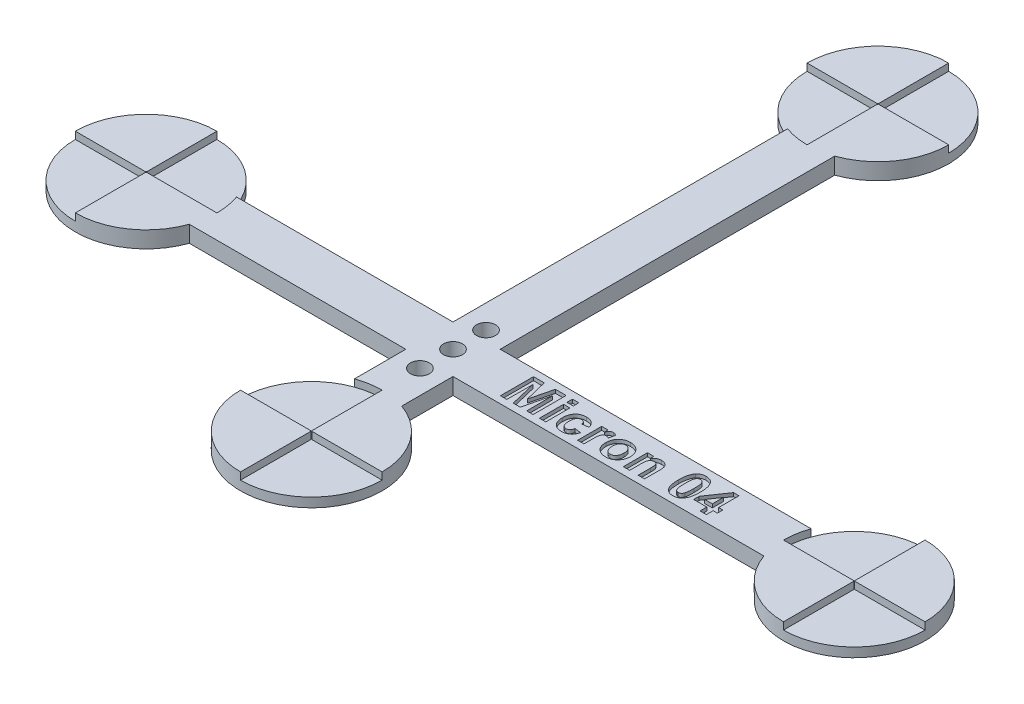
from build123d import *

# Parameters (mm, degrees)
BOSS_EXTRUDE1_DEPTH = 3.5
CUT_EXTRUDE1_START  = -1.52
CUT_EXTRUDE1_DEPTH  = 1.52
SKETCH3_R           = 2
CUT_EXTRUDE2_DEPTH  = 196.607387386
SKETCH5_W           = 1.346153846
SKETCH5_H           = 1.166666667
SKETCH5_H_2         = 5.115384615
CUT_EXTRUDE3_DEPTH  = 0.75


with BuildPart() as part:
    # Sketch1 → Boss-Extrude1 (new body)
    with BuildSketch(Plane(origin=(0, 0, 0), x_dir=(1, 0, 0), z_dir=(0, 1, 0))):
        with BuildLine():
            Line((60, 75.857864376), (60, 5))
            Line((60, 5), (14.142135624, 5))
            ThreePointArc((14.142135624, 5), (-15, 0), (14.142135624, -5))
            Line((14.142135624, -5), (60, -5))
            Line((60, -5), (60, -15.857864376))
            ThreePointArc((60, -15.857864376), (65, -45), (70, -15.857864376))
            Line((70, -15.857864376), (70, -5))
            Line((70, -5), (135.857864376, -5))
            ThreePointArc((135.857864376, -5), (165, 0), (135.857864376, 5))
            Line((135.857864376, 5), (70, 5))
            Line((70, 5), (70, 75.857864376))
            ThreePointArc((70, 75.857864376), (65, 105), (60, 75.857864376))
        make_face()
    extrude(amount=BOSS_EXTRUDE1_DEPTH)

    # Sketch2 → Cut-Extrude1 (cut)
    with BuildSketch(Plane(origin=(0, 3.5, 0), x_dir=(1, 0, 0), z_dir=(0, 1, 0)).offset(CUT_EXTRUDE1_START)):
        with BuildLine():
            Line((65, -45), (65, -30.1))
            ThreePointArc((65, -30.1), (64.929289322, -30.070710678), (64.9, -30))
            Line((64.9, -30), (50, -30))
            ThreePointArc((50, -30), (54.393398282, -19.393398282), (65, -15))
            Line((65, -15), (65, -29.9))
            ThreePointArc((65, -29.9), (65.070710678, -29.929289322), (65.1, -30))
            Line((65.1, -30), (80, -30))
            ThreePointArc((80, -30), (75.606601718, -40.606601718), (65, -45))
        make_face()
        with BuildLine():
            Line((-15, 0), (-0.1, 0))
            ThreePointArc((-0.1, 0), (-0.070710678, 0.070710678), (0, 0.1))
            Line((0, 0.1), (0, 15))
            ThreePointArc((0, 15), (10.606601718, 10.606601718), (15, 0))
            Line((15, 0), (0.1, 0))
            ThreePointArc((0.1, 0), (0.070710678, -0.070710678), (0, -0.1))
            Line((0, -0.1), (0, -15))
            ThreePointArc((0, -15), (-10.606601718, -10.606601718), (-15, 0))
        make_face()
        with BuildLine():
            Line((50, 90), (64.9, 90))
            ThreePointArc((64.9, 90), (64.929289322, 90.070710678), (65, 90.1))
            Line((65, 90.1), (65, 105))
            ThreePointArc((65, 105), (75.606601718, 100.606601718), (80, 90))
            Line((80, 90), (65.1, 90))
            ThreePointArc((65.1, 90), (65.070710678, 89.929289322), (65, 89.9))
            Line((65, 89.9), (65, 75))
            ThreePointArc((65, 75), (54.393398282, 79.393398282), (50, 90))
        make_face()
        with BuildLine():
            Line((150, 15), (150, 0.1))
            ThreePointArc((150, 0.1), (150.070710678, 0.070710678), (150.1, 0))
            Line((150.1, 0), (165, 0))
            ThreePointArc((165, 0), (160.606601718, -10.606601718), (150, -15))
            Line((150, -15), (150, -0.1))
            ThreePointArc((150, -0.1), (149.929289322, -0.070710678), (149.9, 0))
            Line((149.9, 0), (135, 0))
            ThreePointArc((135, 0), (139.393398282, 10.606601718), (150, 15))
        make_face()
    extrude(amount=CUT_EXTRUDE1_DEPTH, mode=Mode.SUBTRACT)

    # Sketch3 → Cut-Extrude2 (cut, through all)
    with BuildSketch(Plane(origin=(0, 3.5, 0), x_dir=(1, 0, 0), z_dir=(0, 1, 0))):
        with Locations(Location((65, 0, 0), (0, 0, 270))):
            Circle(SKETCH3_R)
        with Locations(Location((65, 7, 0), (0, 0, 270))):
            Circle(SKETCH3_R)
        with Locations(Location((65, -7, 0), (0, 0, 270))):
            Circle(SKETCH3_R)
    extrude(amount=-CUT_EXTRUDE2_DEPTH, mode=Mode.SUBTRACT)

    # Sketch5 → Cut-Extrude3 (cut)
    # profile 1 of 9: a face of its own
    with BuildSketch(Plane(origin=(0, 3.5, 0), x_dir=(1, 0, 0), z_dir=(0, 1, 0))):
        Polygon((78.557137316, -3.5), (78.557137316, 3.5), (80.834380906, 3.5), (82.012265521, -1.274639423), (83.190150137, 3.5), (85.467393727, 3.5), (85.467393727, -3.5), (84.12123988, -3.5), (84.076368086, 2.010817308), (82.762465842, -3.5), (81.262065201, -3.5), (79.948162957, 2.010817308), (79.903291162, -3.5), align=None)
    # profile 2 of 9: a face of its own
    with BuildSketch(Plane(origin=(0, 3.5, 0), x_dir=(1, 0, 0), z_dir=(0, 1, 0))):
        with Locations((87.486624496, 2.916666667)):
            Rectangle(SKETCH5_W, SKETCH5_H)
    # profile 3 of 9: a face of its own
    with BuildSketch(Plane(origin=(0, 3.5, 0), x_dir=(1, 0, 0), z_dir=(0, 1, 0))):
        with Locations((87.486624496, -0.942307692)):
            Rectangle(SKETCH5_W, SKETCH5_H_2)
    # profile 4 of 9: a face of its own
    with BuildSketch(Plane(origin=(0, 3.5, 0), x_dir=(1, 0, 0), z_dir=(0, 1, 0))):
        with BuildLine():
            Line((93.723803983, 0.08974359), (92.377650137, -0.08974359))
            add(Edge.make_bspline(
                [(92.377650137, -0.08974359), (92.365277654, -0.026702881), (92.341673882, 0.09356389), (92.281826173, 0.260113107), (92.199974577, 0.401670835), (92.097611893, 0.51732494), (91.97712351, 0.607450251), (91.840268759, 0.673171422), (91.685581657, 0.711401306), (91.577185865, 0.715710363), (91.520879304, 0.717948718)],
                knots=[0, 0, 0, 0, 1.183520367, 2.2578771, 3.246797608, 4.180863388, 5.085846032, 6.003342148, 6.962829327, 8, 8, 8, 8], degree=3))
            add(Edge.make_bspline(
                [(91.520879304, 0.717948718), (91.482498221, 0.716894897), (91.407684642, 0.714840756), (91.298251479, 0.698098117), (91.195737937, 0.667745464), (91.097523133, 0.629114343), (91.006836345, 0.576495155), (90.920991012, 0.514299213), (90.842675236, 0.439090326), (90.769257744, 0.353129964), (90.701753909, 0.253995306), (90.647051205, 0.137976859), (90.599085607, 0.00804074), (90.560102543, -0.137503523), (90.530047591, -0.298346655), (90.507427047, -0.474341951), (90.495339603, -0.665426066), (90.493822197, -0.797860734), (90.493034752, -0.866586538)],
                knots=[0, 0, 0, 0, 0.862078219, 1.680389174, 2.478024961, 3.259954283, 4.04533088, 4.826625376, 5.636266677, 6.477958853, 7.363321064, 8.321359119, 9.351280941, 10.472100686, 11.701575432, 13.024867311, 14.456081111, 16, 16, 16, 16], degree=3))
            add(Edge.make_bspline(
                [(90.493034752, -0.866586538), (90.493639899, -0.942801282), (90.494806774, -1.089762544), (90.509341595, -1.301712899), (90.531002417, -1.496036651), (90.561525189, -1.673267835), (90.601624875, -1.832782613), (90.650795425, -1.975411342), (90.707047794, -2.101633999), (90.776070584, -2.209065714), (90.850031931, -2.303056702), (90.933314865, -2.381466575), (91.019308158, -2.451942196), (91.114884123, -2.505825956), (91.214352737, -2.550853781), (91.321603773, -2.578852356), (91.433547011, -2.60039896), (91.510950539, -2.601834056), (91.550326419, -2.602564103)],
                knots=[0, 0, 0, 0, 1.594318435, 3.074248329, 4.44256617, 5.683784585, 6.834147545, 7.879495874, 8.83778105, 9.716843238, 10.544636748, 11.333080285, 12.105903466, 12.864046512, 13.621684801, 14.38335177, 15.177596319, 16, 16, 16, 16], degree=3))
            add(Edge.make_bspline(
                [(91.550326419, -2.602564103), (91.608100413, -2.600080116), (91.720157046, -2.595262252), (91.879276685, -2.552096012), (92.022202191, -2.482192159), (92.125844391, -2.400004579), (92.201111917, -2.320853296), (92.250138108, -2.247946339), (92.299458931, -2.168177702), (92.339930185, -2.075871785), (92.380235919, -1.975436952), (92.412480151, -1.86369039), (92.444507148, -1.743466381), (92.459601538, -1.65899259), (92.467393727, -1.615384615)],
                knots=[0, 0, 0, 0, 1.391704634, 2.699306801, 3.945045311, 5.206156062, 5.868460975, 6.572467336, 7.320954464, 8.128297893, 8.999513781, 9.930638866, 10.931732014, 12, 12, 12, 12], degree=3))
            Line((92.467393727, -1.615384615), (93.813547573, -1.794871795))
            add(Edge.make_bspline(
                [(93.813547573, -1.794871795), (93.795825896, -1.866656924), (93.76109447, -2.007343377), (93.693590707, -2.209373129), (93.61479608, -2.39820651), (93.525624874, -2.574376956), (93.422745577, -2.73598165), (93.309013151, -2.88413537), (93.183178776, -3.017960811), (93.046861568, -3.139555075), (92.897935718, -3.246410319), (92.736172899, -3.337665389), (92.563936639, -3.416820643), (92.378388792, -3.479144939), (92.181836268, -3.530502493), (91.972413371, -3.564327421), (91.751309208, -3.58604953), (91.599927011, -3.588491221), (91.522281547, -3.58974359)],
                knots=[0, 0, 0, 0, 1.110268429, 2.175934317, 3.195555169, 4.181481111, 5.137790904, 6.068820232, 6.982751273, 7.892872169, 8.808581235, 9.729898078, 10.678730826, 11.651191499, 12.666063818, 13.726769105, 14.834036833, 16, 16, 16, 16], degree=3))
            add(Edge.make_bspline(
                [(91.522281547, -3.58974359), (91.433837068, -3.587598112), (91.261478322, -3.583417051), (91.009756242, -3.550566524), (90.771780691, -3.496564037), (90.547501703, -3.418433664), (90.33596962, -3.32101378), (90.139359833, -3.198661043), (89.956602846, -3.055097693), (89.788125382, -2.890737636), (89.63650412, -2.707369312), (89.505615698, -2.505114604), (89.394554044, -2.286498364), (89.303031081, -2.051298732), (89.233226582, -1.7983952), (89.183681025, -1.529069784), (89.151714713, -1.243154327), (89.148519923, -1.047097203), (89.146880906, -0.946514423)],
                knots=[0, 0, 0, 0, 1.056003706, 2.057917874, 3.026125023, 3.965316587, 4.889355399, 5.801804771, 6.724223409, 7.659808022, 8.607570672, 9.559810849, 10.530974559, 11.531347954, 12.568834288, 13.659317828, 14.799164681, 16, 16, 16, 16], degree=3))
            add(Edge.make_bspline(
                [(89.146880906, -0.946514423), (89.148524185, -0.844997295), (89.151727972, -0.647076357), (89.18360297, -0.358828298), (89.233094763, -0.087580716), (89.30349607, 0.166297338), (89.392466257, 0.40326616), (89.504363423, 0.62183937), (89.635046938, 0.82419118), (89.786794153, 1.007446493), (89.954769379, 1.171954778), (90.138621428, 1.31436025), (90.335702579, 1.436043892), (90.547842096, 1.534147473), (90.773642785, 1.612120293), (91.013992037, 1.665925315), (91.268498667, 1.698802364), (91.442718724, 1.702983298), (91.532097252, 1.705128205)],
                knots=[0, 0, 0, 0, 1.206261992, 2.351765734, 3.442553085, 4.480484798, 5.479315179, 6.445885781, 7.393622348, 8.336902565, 9.26806234, 10.182699256, 11.09556262, 12.0152312, 12.955233282, 13.92969179, 14.937888647, 16, 16, 16, 16], degree=3))
            add(Edge.make_bspline(
                [(91.532097252, 1.705128205), (91.605070142, 1.704384231), (91.747559928, 1.702931518), (91.955377865, 1.681938632), (92.151931544, 1.652324627), (92.3370707, 1.608373074), (92.510877772, 1.55291005), (92.67305557, 1.48425635), (92.822943463, 1.401899226), (92.962440511, 1.308174096), (93.090726225, 1.200105), (93.210447231, 1.080931127), (93.320267383, 0.947732157), (93.421478043, 0.802315403), (93.510713897, 0.64234233), (93.592738582, 0.470830941), (93.663920966, 0.285320122), (93.703546565, 0.155903844), (93.723803983, 0.08974359)],
                knots=[0, 0, 0, 0, 1.178528697, 2.301242291, 3.371523624, 4.388184023, 5.372173667, 6.316227488, 7.228761945, 8.131556558, 9.02696084, 9.934795517, 10.857276148, 11.812560878, 12.793328268, 13.813516901, 14.882225015, 16, 16, 16, 16], degree=3))
        make_face()
    # profile 5 of 9: a face of its own
    with BuildSketch(Plane(origin=(0, 3.5, 0), x_dir=(1, 0, 0), z_dir=(0, 1, 0))):
        with BuildLine():
            Line((96.236624496, -3.5), (94.89047065, -3.5))
            Line((94.89047065, -3.5), (94.89047065, 1.615384615))
            Line((94.89047065, 1.615384615), (96.236624496, 1.615384615))
            Line((96.236624496, 1.615384615), (96.236624496, 0.901642628))
            add(Edge.make_bspline(
                [(96.236624496, 0.901642628), (96.259883743, 0.941904311), (96.304756328, 1.019578614), (96.371134323, 1.130348316), (96.437190473, 1.229067778), (96.502313101, 1.315738052), (96.562695006, 1.393610289), (96.624125097, 1.458290396), (96.681838486, 1.513862665), (96.759057766, 1.569417784), (96.85816177, 1.623638198), (96.982722375, 1.672376349), (97.116123027, 1.699014333), (97.206867798, 1.7030602), (97.253251098, 1.705128205)],
                knots=[0, 0, 0, 0, 1.218987753, 2.351715484, 3.384890168, 4.330893419, 5.1939795, 5.965577503, 6.66790098, 7.29043559, 8.453252551, 9.620708942, 10.783848683, 12, 12, 12, 12], degree=3))
            add(Edge.make_bspline(
                [(97.253251098, 1.705128205), (97.320405095, 1.701358096), (97.455282291, 1.693785921), (97.655090934, 1.639699112), (97.849368018, 1.548142305), (97.969512799, 1.464847397), (98.031496291, 1.421875)],
                knots=[0, 0, 0, 0, 0.956058025, 1.920219652, 2.927027487, 4, 4, 4, 4], degree=3))
            Line((98.031496291, 1.421875), (97.717393727, 0.141626603))
            add(Edge.make_bspline(
                [(97.717393727, 0.141626603), (97.664449803, 0.174925236), (97.563581431, 0.238365546), (97.406138295, 0.305762948), (97.25470486, 0.349888023), (97.154428404, 0.35601587), (97.106015521, 0.358974359)],
                knots=[0, 0, 0, 0, 1.139741959, 2.17142794, 3.117176162, 4, 4, 4, 4], degree=3))
            add(Edge.make_bspline(
                [(97.106015521, 0.358974359), (97.062383442, 0.357110478), (96.977443556, 0.353482004), (96.855168651, 0.324585509), (96.742438401, 0.278028965), (96.638804629, 0.211102954), (96.546124762, 0.117496866), (96.466335118, -0.005816935), (96.399557381, -0.159976511), (96.348517599, -0.309611834), (96.316692358, -0.455051639), (96.294248724, -0.593539742), (96.277196049, -0.759330249), (96.261585532, -0.951920701), (96.251121722, -1.171736755), (96.242884255, -1.418086441), (96.236934639, -1.691545137), (96.236731023, -1.882742337), (96.236624496, -1.982772436)],
                knots=[0, 0, 0, 0, 0.752818562, 1.4655346, 2.15662141, 2.850671748, 3.581264886, 4.414089304, 5.371394652, 6.476667933, 7.138571115, 7.940099809, 8.898357565, 10.015825393, 11.276710544, 12.698206094, 14.272575274, 16, 16, 16, 16], degree=3))
            Line((96.236624496, -1.982772436), (96.236624496, -3.5))
        make_face()
    # profile 6 of 9: a face of its own
    with BuildSketch(Plane(origin=(0, 3.5, 0), x_dir=(1, 0, 0), z_dir=(0, 1, 0))):
        with BuildLine():
            add(Edge.make_bspline(
                [(98.30072706, -0.870793269), (98.305045962, -0.760235903), (98.313692137, -0.538906871), (98.37545065, -0.210134176), (98.479986613, 0.112038713), (98.596998472, 0.373436964), (98.712536167, 0.573274145), (98.805840225, 0.717377785), (98.910004027, 0.850655554), (99.022895624, 0.973952054), (99.141975554, 1.090223099), (99.271436787, 1.195191373), (99.409604934, 1.290665645), (99.555130892, 1.377699163), (99.70780662, 1.45411696), (99.864797668, 1.522044624), (100.026738449, 1.577858255), (100.192500665, 1.624143401), (100.362803099, 1.66126573), (100.537692719, 1.68557028), (100.716957733, 1.701776453), (100.837816813, 1.704000672), (100.899084432, 1.705128205)],
                knots=[0, 0, 0, 0, 1.619840069, 3.242819969, 4.882696853, 6.574901176, 7.427927767, 8.263869039, 9.088735507, 9.903385011, 10.712399333, 11.525463381, 12.34252837, 13.171904741, 14.008210778, 14.842888174, 15.67691885, 16.516221154, 17.363978437, 18.229048737, 19.10224397, 20, 20, 20, 20], degree=3))
            add(Edge.make_bspline(
                [(100.899084432, 1.705128205), (100.992210311, 1.703136544), (101.175407967, 1.69921854), (101.443599, 1.663530133), (101.69856042, 1.604734262), (101.940636298, 1.522866388), (102.170009096, 1.417918164), (102.385525042, 1.287469155), (102.588964705, 1.13534666), (102.776477597, 0.960622814), (102.947873031, 0.769310702), (103.096522834, 0.562484273), (103.223397384, 0.344144411), (103.328477544, 0.113944009), (103.408239879, -0.129331778), (103.463344151, -0.385087436), (103.500243667, -0.652374343), (103.50396088, -0.835142162), (103.505855265, -0.928285256)],
                knots=[0, 0, 0, 0, 1.076054793, 2.116819909, 3.120736197, 4.09633837, 5.065772102, 6.030360709, 7.002891056, 7.996945094, 8.988102315, 9.967288529, 10.93568283, 11.902870597, 12.887008047, 13.888537105, 14.923945207, 16, 16, 16, 16], degree=3))
            add(Edge.make_bspline(
                [(103.505855265, -0.928285256), (103.503953336, -1.022358858), (103.500230128, -1.20651696), (103.463550334, -1.47628572), (103.406832368, -1.734301905), (103.325441844, -1.980042151), (103.220586913, -2.213224526), (103.094263796, -2.434645511), (102.943126034, -2.643140663), (102.770071096, -2.836536926), (102.580135887, -3.012216977), (102.378157233, -3.168393642), (102.161698021, -3.297146595), (101.934555313, -3.405413896), (101.694392155, -3.48757604), (101.442576838, -3.546181121), (101.179301383, -3.58440277), (100.999247208, -3.587940756), (100.907497893, -3.58974359)],
                knots=[0, 0, 0, 0, 1.084306555, 2.122634113, 3.133511532, 4.127271514, 5.10202058, 6.077484774, 7.061903265, 8.065960046, 9.065303363, 10.042062392, 11.004391854, 11.964060687, 12.939122686, 13.924942149, 14.942623041, 16, 16, 16, 16], degree=3))
            add(Edge.make_bspline(
                [(100.907497893, -3.58974359), (100.793197459, -3.585999314), (100.565409876, -3.578537406), (100.228332141, -3.517331391), (99.899580393, -3.418578363), (99.634721788, -3.30491006), (99.432398884, -3.194068459), (99.2889167, -3.100765628), (99.153600151, -3.000634417), (99.029615405, -2.888525117), (98.914822638, -2.767656905), (98.80770116, -2.639200059), (98.712065202, -2.500189519), (98.625243515, -2.353150853), (98.547337372, -2.197033104), (98.482391397, -2.031407384), (98.425965203, -1.858219085), (98.379426741, -1.677074935), (98.344918868, -1.487198195), (98.319828269, -1.289197267), (98.304105213, -1.082783839), (98.301867118, -0.942335777), (98.30072706, -0.870793269)],
                knots=[0, 0, 0, 0, 1.610846835, 3.210231987, 4.81374032, 6.443368681, 7.263437361, 8.06418174, 8.855100662, 9.634539345, 10.417731031, 11.204243685, 11.990424874, 12.794120493, 13.610605693, 14.447765341, 15.300248309, 16.177865431, 17.082777535, 18.019649293, 18.991233806, 20, 20, 20, 20], degree=3))
        make_face()
        with BuildLine():
            add(Edge.make_bspline(
                [(99.646880906, -0.942307692), (99.647878584, -1.007320767), (99.649820064, -1.133836228), (99.667123886, -1.317908247), (99.693943922, -1.490762442), (99.735361519, -1.650791958), (99.785307076, -1.800159307), (99.848707519, -1.936877885), (99.921153825, -2.063536994), (100.007373027, -2.1753987), (100.101343593, -2.274418694), (100.199833871, -2.36240354), (100.303809872, -2.437322036), (100.41391022, -2.49823268), (100.529998823, -2.544473448), (100.650705668, -2.578404662), (100.776898878, -2.59833825), (100.862556349, -2.601139991), (100.90609565, -2.602564103)],
                knots=[0, 0, 0, 0, 1.334287467, 2.596523749, 3.792235791, 4.920928783, 5.98599801, 7.020725633, 8.009778093, 8.975087571, 9.91178927, 10.809031968, 11.682407688, 12.537028737, 13.385161363, 14.241880569, 15.106355953, 16, 16, 16, 16], degree=3))
            add(Edge.make_bspline(
                [(100.90609565, -2.602564103), (100.949636837, -2.601144665), (101.035298021, -2.598352119), (101.161464162, -2.578351489), (101.281853749, -2.544786823), (101.397190506, -2.497854846), (101.507005984, -2.437377328), (101.61091724, -2.362353397), (101.709336483, -2.274781598), (101.802542893, -2.175227372), (101.886267606, -2.061842509), (101.959423839, -1.935578805), (102.022822325, -1.79833688), (102.072998654, -1.64817726), (102.112146338, -1.486306038), (102.139600285, -1.312329148), (102.15676443, -1.126346658), (102.158702325, -0.99843674), (102.159701419, -0.932491987)],
                knots=[0, 0, 0, 0, 0.891374549, 1.753654511, 2.608197993, 3.445305504, 4.297756158, 5.168913853, 6.063877914, 6.991658187, 7.956416983, 8.942957645, 9.975057474, 11.046479855, 12.179282068, 13.381405243, 14.649967197, 16, 16, 16, 16], degree=3))
            add(Edge.make_bspline(
                [(102.159701419, -0.932491987), (102.158697367, -0.867950124), (102.156751088, -0.742840612), (102.139683714, -0.561031756), (102.111771172, -0.390422553), (102.073298945, -0.231185172), (102.022561895, -0.083047614), (101.959026888, 0.052619974), (101.886748624, 0.178516236), (101.80205349, 0.290714614), (101.709395678, 0.390209804), (101.610902071, 0.477726842), (101.507009908, 0.552764833), (101.397189486, 0.61323871), (101.281854027, 0.660171642), (101.161464087, 0.693736048), (101.035298041, 0.713736749), (100.949636844, 0.716529285), (100.90609565, 0.717948718)],
                knots=[0, 0, 0, 0, 1.332105243, 2.582185114, 3.76554119, 4.898206757, 5.96011018, 6.991864232, 7.986448439, 8.951336849, 9.886681577, 10.788942532, 11.667203022, 12.526603947, 13.370536632, 14.232047448, 15.101357822, 16, 16, 16, 16], degree=3))
            add(Edge.make_bspline(
                [(100.90609565, 0.717948718), (100.862556349, 0.716524606), (100.776898878, 0.713722865), (100.650705668, 0.693789278), (100.529998823, 0.659858063), (100.41391022, 0.613617296), (100.303809872, 0.552706651), (100.199833871, 0.477788156), (100.101343593, 0.38980331), (100.007373027, 0.290783316), (99.921153825, 0.17892161), (99.848707519, 0.052262501), (99.785307076, -0.084456078), (99.735361519, -0.233823426), (99.693943922, -0.393852943), (99.667123886, -0.566707137), (99.649820064, -0.750779157), (99.647878584, -0.877294617), (99.646880906, -0.942307692)],
                knots=[0, 0, 0, 0, 0.893644047, 1.758119431, 2.614838637, 3.462971263, 4.317592312, 5.190968032, 6.08821073, 7.024912429, 7.990221907, 8.979274367, 10.01400199, 11.079071217, 12.207764209, 13.403476251, 14.665712533, 16, 16, 16, 16], degree=3))
        make_face(mode=Mode.SUBTRACT)
    # profile 7 of 9: a face of its own
    with BuildSketch(Plane(origin=(0, 3.5, 0), x_dir=(1, 0, 0), z_dir=(0, 1, 0))):
        with BuildLine():
            Line((109.069957829, -3.5), (107.723803983, -3.5))
            Line((107.723803983, -3.5), (107.723803983, -0.875))
            add(Edge.make_bspline(
                [(107.723803983, -0.875), (107.723602692, -0.80862339), (107.723218494, -0.681932094), (107.718527885, -0.50151225), (107.713477967, -0.33926398), (107.705359809, -0.195690673), (107.69420945, -0.069881136), (107.680940928, 0.037381776), (107.664227581, 0.126316058), (107.640514055, 0.219075396), (107.603280694, 0.31750614), (107.542853534, 0.419454306), (107.472803641, 0.509977418), (107.387946168, 0.584030176), (107.292843867, 0.643744945), (107.188425092, 0.687766967), (107.073926815, 0.713473714), (106.994769027, 0.71642676), (106.953972252, 0.717948718)],
                knots=[0, 0, 0, 0, 1.585090075, 3.025419896, 4.30986405, 5.461533023, 6.458985685, 7.325703005, 8.041573048, 8.618245387, 9.611190897, 10.541623111, 11.439410311, 12.333024322, 13.215695708, 14.111259627, 15.026570636, 16, 16, 16, 16], degree=3))
            add(Edge.make_bspline(
                [(106.953972252, 0.717948718), (106.901446439, 0.715341443), (106.798008909, 0.710207014), (106.646127096, 0.674643139), (106.504272122, 0.611656212), (106.371854194, 0.527573319), (106.255091054, 0.423166044), (106.155813236, 0.301229295), (106.077510643, 0.163292863), (106.028725935, 0.034500293), (105.9997776, -0.082074788), (105.980077313, -0.18736516), (105.965963353, -0.310222482), (105.951055688, -0.449397921), (105.942646526, -0.606201002), (105.933263474, -0.779079665), (105.929808832, -0.969405207), (105.929233196, -1.1016966), (105.928932188, -1.170873397)],
                knots=[0, 0, 0, 0, 1.032418065, 2.033110358, 3.045378521, 4.070039643, 5.104744895, 6.110696385, 7.147805894, 8.209255037, 8.806501049, 9.507534436, 10.313289552, 11.236712342, 12.258650821, 13.399345464, 14.640085731, 16, 16, 16, 16], degree=3))
            Line((105.928932188, -1.170873397), (105.928932188, -3.5))
            Line((105.928932188, -3.5), (104.582778342, -3.5))
            Line((104.582778342, -3.5), (104.582778342, 1.615384615))
            Line((104.582778342, 1.615384615), (105.928932188, 1.615384615))
            Line((105.928932188, 1.615384615), (105.928932188, 0.877804487))
            add(Edge.make_bspline(
                [(105.928932188, 0.877804487), (105.980976174, 0.94337945), (106.08236259, 1.07112544), (106.252101926, 1.240902011), (106.431871591, 1.384984638), (106.622482327, 1.502597736), (106.823836354, 1.593383288), (107.035011442, 1.657323362), (107.256181645, 1.698687167), (107.407176778, 1.702955825), (107.484020329, 1.705128205)],
                knots=[0, 0, 0, 0, 1.096260936, 2.135615983, 3.138008533, 4.108575778, 5.062498258, 6.023394349, 6.994077526, 8, 8, 8, 8], degree=3))
            add(Edge.make_bspline(
                [(107.484020329, 1.705128205), (107.551455459, 1.703432581), (107.684254807, 1.700093404), (107.87840855, 1.668042033), (108.063790206, 1.617716821), (108.237815142, 1.547521772), (108.39780225, 1.463814733), (108.538360931, 1.365944084), (108.659178646, 1.258012012), (108.758264399, 1.136836476), (108.838935335, 1.006444736), (108.909151731, 0.869613801), (108.963410859, 0.7231182), (109.005291646, 0.56393665), (109.033684021, 0.383505727), (109.056317805, 0.173923523), (109.067737625, -0.069988674), (109.069186888, -0.243982006), (109.069957829, -0.336538462)],
                knots=[0, 0, 0, 0, 1.087471829, 2.141547729, 3.166311014, 4.181815879, 5.163737, 6.073971965, 6.939083136, 7.769667735, 8.590016746, 9.409741311, 10.247555639, 11.105633939, 12.06171977, 13.192085209, 14.506318385, 16, 16, 16, 16], degree=3))
            Line((109.069957829, -0.336538462), (109.069957829, -3.5))
        make_face()
    # profile 8 of 9: a face of its own
    with BuildSketch(Plane(origin=(0, 3.5, 0), x_dir=(1, 0, 0), z_dir=(0, 1, 0))):
        with BuildLine():
            add(Edge.make_bspline(
                [(115.127650137, 3.5), (115.210973459, 3.497990296), (115.373194416, 3.494077632), (115.609568213, 3.459418509), (115.832125907, 3.403844539), (116.040851165, 3.325286793), (116.235548447, 3.223275021), (116.414920872, 3.097373283), (116.582887972, 2.951355615), (116.679882834, 2.838043484), (116.729012316, 2.780649038)],
                knots=[0, 0, 0, 0, 1.098584764, 2.138818609, 3.143716932, 4.11936356, 5.073598562, 6.034819447, 7.004603936, 8, 8, 8, 8], degree=3))
            add(Edge.make_bspline(
                [(116.729012316, 2.780649038), (116.757115165, 2.744096358), (116.814468155, 2.669498744), (116.89170974, 2.548957239), (116.965967015, 2.421089291), (117.030786368, 2.282817073), (117.092853708, 2.136540065), (117.150372484, 1.981924967), (117.200314244, 1.817694297), (117.24730652, 1.645948025), (117.285600914, 1.464003892), (117.320988477, 1.273826094), (117.350326359, 1.07455247), (117.373461009, 0.866820582), (117.394122544, 0.650946485), (117.405444064, 0.425900053), (117.414713976, 0.192183791), (117.415640415, 0.033196977), (117.416111675, -0.047676282)],
                knots=[0, 0, 0, 0, 0.746761706, 1.524009783, 2.317797294, 3.140957436, 3.996208027, 4.892396322, 5.812273159, 6.776774596, 7.776522781, 8.823794876, 9.910947555, 11.039215469, 12.21036455, 13.424061321, 14.689674014, 16, 16, 16, 16], degree=3))
            add(Edge.make_bspline(
                [(117.416111675, -0.047676282), (117.415647514, -0.128549727), (117.414737711, -0.287069766), (117.405409505, -0.520317147), (117.394112451, -0.744894367), (117.37350921, -0.960779993), (117.350153056, -1.168470585), (117.32165396, -1.36752083), (117.283603433, -1.556824756), (117.245911455, -1.7384787), (117.199194678, -1.910956219), (117.147008626, -2.074892373), (117.09180168, -2.231434895), (117.028291268, -2.377900211), (116.961146178, -2.516343538), (116.887993989, -2.64551665), (116.809889936, -2.766805201), (116.751982092, -2.841796361), (116.723403342, -2.87880609)],
                knots=[0, 0, 0, 0, 1.308387162, 2.564569672, 3.776470597, 4.945886788, 6.07248526, 7.158029334, 8.197718558, 9.195987466, 10.159061779, 11.087054987, 11.979325145, 12.84323098, 13.668471539, 14.467659354, 15.243757377, 16, 16, 16, 16], degree=3))
            add(Edge.make_bspline(
                [(116.723403342, -2.87880609), (116.674723363, -2.935708583), (116.578626735, -3.048036851), (116.412518637, -3.192843578), (116.233443571, -3.316141502), (116.039089218, -3.416126038), (115.831383863, -3.495225841), (115.60846196, -3.549026443), (115.372733911, -3.583756125), (115.210509985, -3.587719301), (115.127650137, -3.58974359)],
                knots=[0, 0, 0, 0, 0.991631672, 1.957528776, 2.911425699, 3.867574088, 4.848108326, 5.850523106, 6.902101959, 8, 8, 8, 8], degree=3))
            add(Edge.make_bspline(
                [(115.127650137, -3.58974359), (115.043843229, -3.587332075), (114.87961925, -3.582606588), (114.639845122, -3.545146301), (114.411928808, -3.485135154), (114.196688524, -3.399455235), (113.99443224, -3.288420347), (113.80357985, -3.155320137), (113.628283527, -2.994127791), (113.491045634, -2.844066609), (113.390641979, -2.708475295), (113.319827907, -2.596038127), (113.251393654, -2.475725869), (113.192326668, -2.343776957), (113.134051837, -2.204094043), (113.08243865, -2.05366677), (113.036902449, -1.893788664), (112.994146853, -1.725189777), (112.958494985, -1.546708789), (112.925700499, -1.358872406), (112.899856676, -1.160881808), (112.876943465, -0.953839776), (112.860811252, -0.737257565), (112.847709837, -0.5114896), (112.841140381, -0.275813207), (112.839847904, -0.115454427), (112.839188598, -0.033653846)],
                knots=[0, 0, 0, 0, 1.257818097, 2.464759732, 3.634271214, 4.790227596, 5.933394726, 7.09190477, 8.274482889, 9.50191983, 10.139172818, 10.805000628, 11.49619854, 12.215266328, 12.973768034, 13.768328009, 14.601232062, 15.469317089, 16.379095881, 17.333267023, 18.331755967, 19.376479622, 20.460535752, 21.592206075, 22.771760786, 24, 24, 24, 24], degree=3))
            add(Edge.make_bspline(
                [(112.839188598, -0.033653846), (112.839649053, 0.046752502), (112.840551486, 0.204338611), (112.849947717, 0.43664665), (112.861095479, 0.6603017), (112.881922973, 0.875695222), (112.904951542, 1.082498955), (112.93397868, 1.280985552), (112.971083155, 1.47012808), (113.011481896, 1.65068144), (113.055796554, 1.823285057), (113.10846774, 1.986496157), (113.163122902, 2.142783223), (113.227375619, 2.288467292), (113.294108477, 2.426619238), (113.367317908, 2.555768146), (113.445407553, 2.677062789), (113.503317262, 2.75205316), (113.531896932, 2.7890625)],
                knots=[0, 0, 0, 0, 1.304469132, 2.556591843, 3.77188756, 4.93702727, 6.066781583, 7.147865049, 8.190466662, 9.19316792, 10.149665317, 11.080258032, 11.975027628, 12.834388201, 13.661940433, 14.463366943, 15.241638981, 16, 16, 16, 16], degree=3))
            add(Edge.make_bspline(
                [(113.531896932, 2.7890625), (113.580574234, 2.845970467), (113.676665577, 2.958309541), (113.842812364, 3.103037161), (114.022085413, 3.226867293), (114.217008558, 3.32565506), (114.424237765, 3.405839286), (114.646867933, 3.45921057), (114.882558423, 3.494031913), (115.044787604, 3.497982262), (115.127650137, 3.5)],
                knots=[0, 0, 0, 0, 0.991667276, 1.957599061, 2.911530233, 3.873218945, 4.847995157, 5.850445929, 6.902062539, 8, 8, 8, 8], degree=3))
        make_face()
        with BuildLine():
            add(Edge.make_bspline(
                [(115.127650137, 2.333333333), (115.08496527, 2.331377346), (115.000530703, 2.327508224), (114.877806939, 2.298834269), (114.761904466, 2.251515994), (114.65226456, 2.185460295), (114.551309982, 2.09356773), (114.46579241, 1.970359526), (114.391937624, 1.819162626), (114.35497736, 1.706149177), (114.335382509, 1.646233974)],
                knots=[0, 0, 0, 0, 0.899391665, 1.779078861, 2.640979247, 3.529945348, 4.464599804, 5.495588918, 6.672261578, 8, 8, 8, 8], degree=3))
            add(Edge.make_bspline(
                [(114.335382509, 1.646233974), (114.323145186, 1.601026296), (114.296843942, 1.503863032), (114.266993122, 1.34544653), (114.242375766, 1.165660571), (114.221588896, 0.964546936), (114.204672766, 0.741999201), (114.19425523, 0.497875761), (114.187054818, 0.232347672), (114.185928426, 0.048149154), (114.185342445, -0.047676282)],
                knots=[0, 0, 0, 0, 0.658986521, 1.416336438, 2.266694271, 3.212608458, 4.261595115, 5.407496572, 6.651304179, 8, 8, 8, 8], degree=3))
            add(Edge.make_bspline(
                [(114.185342445, -0.047676282), (114.186141326, -0.14302767), (114.187672646, -0.32580029), (114.19202109, -0.588135115), (114.204364221, -0.826933735), (114.216718503, -1.043147789), (114.237295105, -1.23609601), (114.257990887, -1.406299418), (114.286516619, -1.552595599), (114.325438332, -1.711718991), (114.384302432, -1.878266865), (114.465062219, -2.04628923), (114.551664335, -2.181203321), (114.6536661, -2.277800907), (114.764061896, -2.342600939), (114.878564469, -2.390212927), (115.001176477, -2.416929723), (115.084994509, -2.421003664), (115.127650137, -2.423076923)],
                knots=[0, 0, 0, 0, 1.613353868, 3.092528792, 4.438413522, 5.658843895, 6.755779493, 7.721003256, 8.558527904, 9.275869043, 10.491421475, 11.538327284, 12.426656321, 13.187490948, 13.890032692, 14.581719216, 15.278226227, 16, 16, 16, 16], degree=3))
            add(Edge.make_bspline(
                [(115.127650137, -2.423076923), (115.1708259, -2.421220141), (115.255319219, -2.417586488), (115.378203772, -2.38795648), (115.494271269, -2.342061023), (115.60317755, -2.274658528), (115.704037572, -2.183395172), (115.789492715, -2.06007625), (115.863367243, -1.908914362), (115.900324505, -1.795895589), (115.919917765, -1.735977564)],
                knots=[0, 0, 0, 0, 0.909107913, 1.77908945, 2.650019014, 3.530482969, 4.465025013, 5.495890128, 6.672421267, 8, 8, 8, 8], degree=3))
            add(Edge.make_bspline(
                [(115.919917765, -1.735977564), (115.932137385, -1.690766299), (115.958280861, -1.594038281), (115.988344392, -1.436607964), (116.013028395, -1.257753647), (116.033617624, -1.05755488), (116.050700146, -0.835487867), (116.061029249, -0.591824852), (116.068236435, -0.326765589), (116.06936967, -0.143034371), (116.069957829, -0.047676282)],
                knots=[0, 0, 0, 0, 0.66114423, 1.414496391, 2.261103113, 3.210114492, 4.255954433, 5.405607896, 6.653488082, 8, 8, 8, 8], degree=3))
            add(Edge.make_bspline(
                [(116.069957829, -0.047676282), (116.070022861, 0.04768509), (116.070147527, 0.230491244), (116.061887947, 0.493159052), (116.05378189, 0.732661087), (116.037252258, 0.948528178), (116.020696375, 1.141489365), (115.996032219, 1.310578558), (115.971185025, 1.457659427), (115.92872111, 1.616451226), (115.871012304, 1.783477729), (115.79217116, 1.953246036), (115.703049418, 2.086895444), (115.601786966, 2.185134457), (115.491934543, 2.251358804), (115.377150964, 2.29911527), (115.254748437, 2.32746093), (115.170327908, 2.331361465), (115.127650137, 2.333333333)],
                knots=[0, 0, 0, 0, 1.611146624, 3.088541111, 4.440175916, 5.659517762, 6.746360572, 7.711365618, 8.546319149, 9.264661039, 10.486047304, 11.528122518, 12.419721574, 13.184982167, 13.89070983, 14.574167459, 15.279187713, 16, 16, 16, 16], degree=3))
        make_face(mode=Mode.SUBTRACT)
    # profile 9 of 9: a face of its own
    with BuildSketch(Plane(origin=(0, 3.5, 0), x_dir=(1, 0, 0), z_dir=(0, 1, 0))):
        Polygon((120.826368086, -3.5), (120.826368086, -2.064102564), (118.044316804, -2.064102564), (118.044316804, -0.901642628), (121.004453021, 3.41025641), (122.172521932, 3.41025641), (122.172521932, -0.897435897), (123.069957829, -0.897435897), (123.069957829, -2.064102564), (122.172521932, -2.064102564), (122.172521932, -3.5), align=None)
        Polygon((120.826368086, -0.897435897), (120.826368086, 1.433092949), (119.225005906, -0.897435897), align=None, mode=Mode.SUBTRACT)
    extrude(amount=-CUT_EXTRUDE3_DEPTH, mode=Mode.SUBTRACT)


solid = part.part
